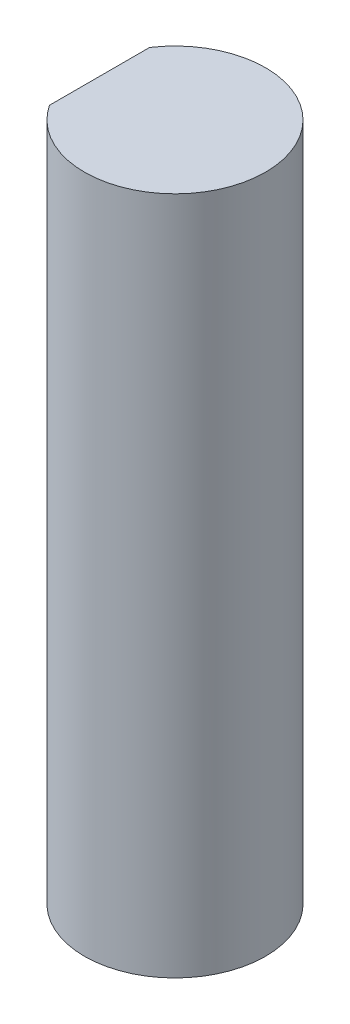
from build123d import *

# Parameters (mm, degrees)
SKETCH_1_R          = 3
EXTRUDE_1_DEPTH     = 22.5
CUT_EXTRUDE_START   = -10
CUT_EXTRUDE_1_DEPTH = 10


with BuildPart() as part:
    # 草图1 → 凸台-拉伸1 (new body)
    with BuildSketch(Plane(origin=(0, 0, 0), x_dir=(1, 0, 0), z_dir=(0, 1, 0))):
        with Locations(Location((0, 0, 0), (0, 0, 90))):
            Circle(SKETCH_1_R)
    extrude(amount=EXTRUDE_1_DEPTH)

    # 草图3 → 切除-拉伸1 (cut)
    with BuildSketch(Plane(origin=(0, 22.5, 0), x_dir=(1, 0, 0), z_dir=(0, 1, 0)).offset(CUT_EXTRUDE_START)):
        with BuildLine():
            Line((-2.5, -1.658312395), (-2.5, 1.658312395))
            ThreePointArc((-2.5, 1.658312395), (-3, 0), (-2.5, -1.658312395))
        make_face()
    extrude(amount=CUT_EXTRUDE_1_DEPTH, mode=Mode.SUBTRACT)


solid = part.part
